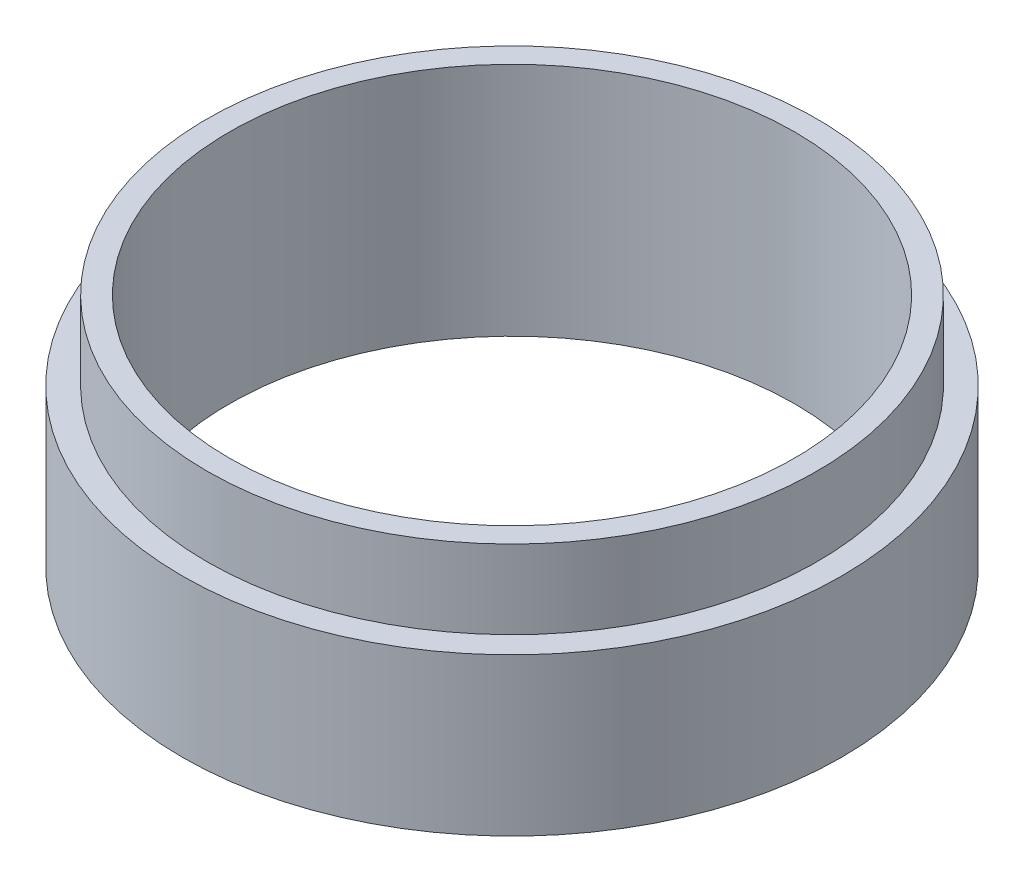
from build123d import *

# Parameters (mm, degrees)
SKETCH1_W           = 21
SKETCH1_H           = 10
SKETCH2_R           = 18
CUT_EXTRUDE1_DEPTH  = 32.336879232
SKETCH4_R           = 19.43
BOSS_EXTRUDE1_DEPTH = 5
SKETCH5_R           = 18
CUT_EXTRUDE2_DEPTH  = 34.271609519


with BuildPart() as part:
    # Sketch1 → Revolve1 (revolve)
    with BuildSketch(Plane.XY, mode=Mode.PRIVATE) as revolve1_sk:
        with Locations((10.5, 5)):
            Rectangle(SKETCH1_W, SKETCH1_H)
    revolve(revolve1_sk.sketch.rotate(Axis((0, 0, 0), (0, 1, 0)), 90), axis=Axis((0, 0, 0), (0, 1, 0)))

    # Sketch2 → Cut-Extrude1 (cut, through all)
    with BuildSketch(Plane(origin=(0, 10, 0), x_dir=(1, 0, 0), z_dir=(0, 1, 0))):
        with Locations(Location((0, 0, 0), (0, 0, 270))):
            Circle(SKETCH2_R)
    extrude(amount=-CUT_EXTRUDE1_DEPTH, mode=Mode.SUBTRACT)

    # Sketch4 → Boss-Extrude1 (add)
    with BuildSketch(Plane(origin=(0, 10, 0), x_dir=(1, 0, 0), z_dir=(0, 1, 0))):
        with Locations(Location((0, 0, 0), (0, 0, 270))):
            Circle(SKETCH4_R)
    extrude(amount=BOSS_EXTRUDE1_DEPTH)

    # Sketch5 → Cut-Extrude2 (cut, through all)
    with BuildSketch(Plane(origin=(0, 15, 0), x_dir=(1, 0, 0), z_dir=(0, 1, 0))):
        with Locations(Location((0, 0, 0), (0, 0, 270))):
            Circle(SKETCH5_R)
    extrude(amount=-CUT_EXTRUDE2_DEPTH, mode=Mode.SUBTRACT)


solid = part.part
